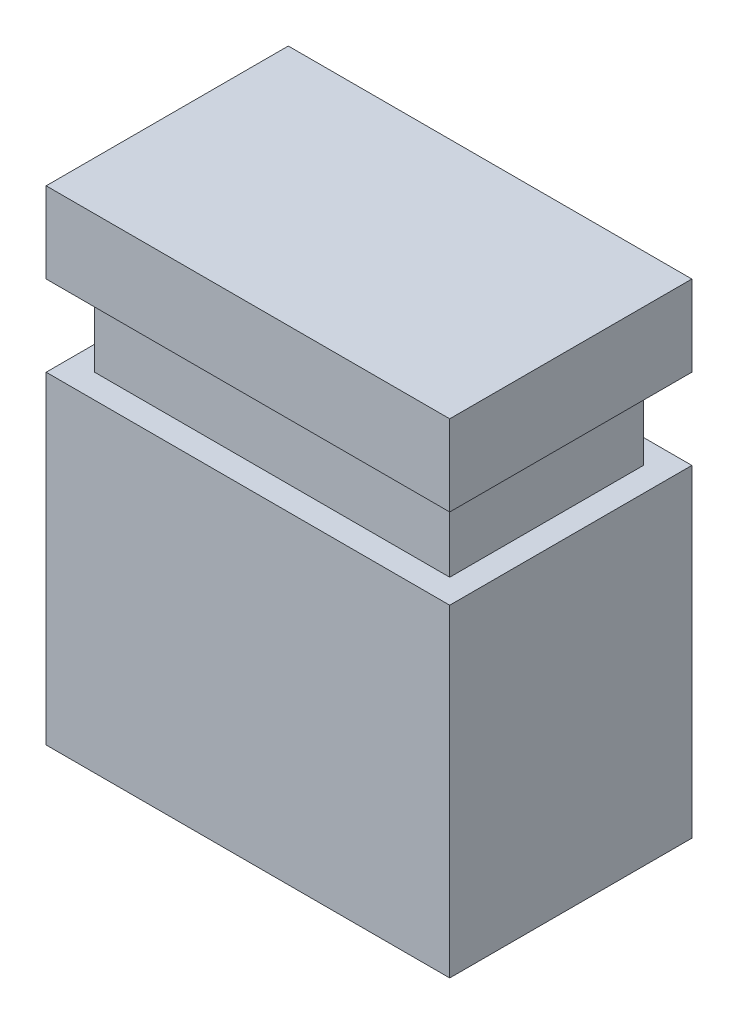
from build123d import *

# Parameters (mm, degrees)
SKETCH1_W           = 2.5
SKETCH1_H           = 1.5
BOSS_EXTRUDE1_DEPTH = 2
SKETCH2_W           = 2.2
SKETCH2_H           = 1.2
BOSS_EXTRUDE2_DEPTH = 0.5
SKETCH3_W           = 2.5
SKETCH3_H           = 1.5
BOSS_EXTRUDE3_DEPTH = 0.5
SKETCH5_W           = 2
SKETCH5_H           = 1
CUT_EXTRUDE1_DEPTH  = 0.2
SKETCH6_W           = 0.5
SKETCH6_H           = 0.5
CUT_EXTRUDE2_DEPTH  = 2.3


with BuildPart() as part:
    # Sketch1 → Boss-Extrude1 (new body)
    with BuildSketch(Plane(origin=(0, 0, 0), x_dir=(1, 0, 0), z_dir=(0, 1, 0))):
        Rectangle(SKETCH1_W, SKETCH1_H)
    extrude(amount=BOSS_EXTRUDE1_DEPTH)

    # Sketch2 → Boss-Extrude2 (add)
    with BuildSketch(Plane(origin=(0, 2, 0), x_dir=(1, 0, 0), z_dir=(0, 1, 0))):
        Rectangle(SKETCH2_W, SKETCH2_H)
    extrude(amount=BOSS_EXTRUDE2_DEPTH)

    # Sketch3 → Boss-Extrude3 (add)
    with BuildSketch(Plane(origin=(0, 2.5, 0), x_dir=(1, 0, 0), z_dir=(0, 1, 0))):
        Rectangle(SKETCH3_W, SKETCH3_H)
    extrude(amount=BOSS_EXTRUDE3_DEPTH)

    # Sketch5 → Cut-Extrude1 (cut)
    with BuildSketch(Plane.XZ):
        Rectangle(SKETCH5_W, SKETCH5_H)
    extrude(amount=-CUT_EXTRUDE1_DEPTH, mode=Mode.SUBTRACT)

    # Sketch6 → Cut-Extrude2 (cut)
    with BuildSketch(Plane.XZ.offset(-0.2)):
        with Locations((-0.635, 0)):
            Rectangle(SKETCH6_W, SKETCH6_H)
        with Locations((0.635, 0)):
            Rectangle(SKETCH6_W, SKETCH6_H)
    extrude(amount=-CUT_EXTRUDE2_DEPTH, mode=Mode.SUBTRACT)


solid = part.part
